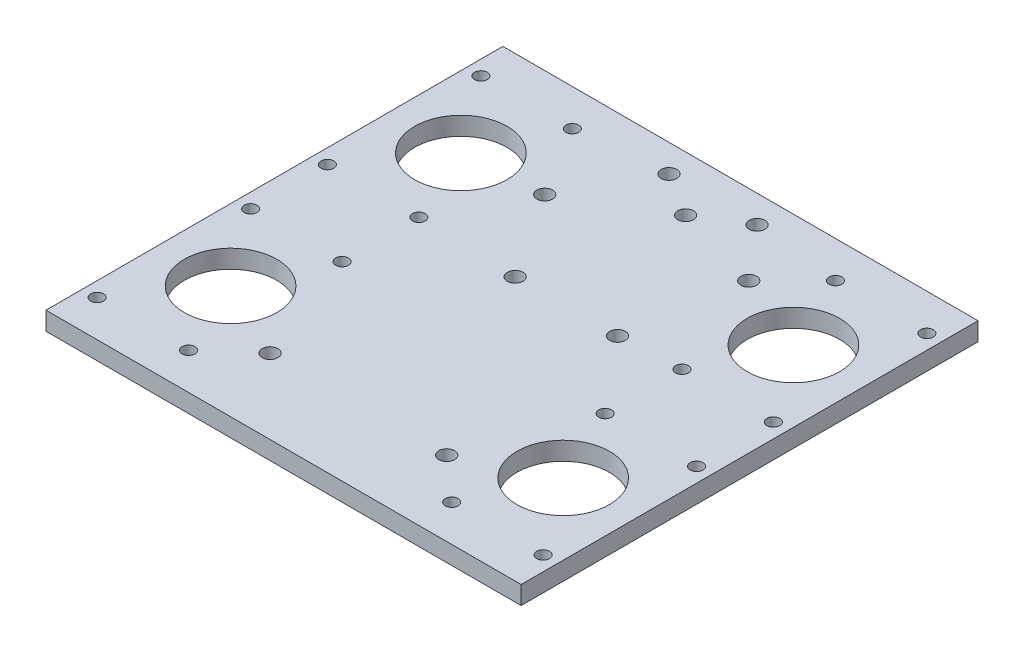
from build123d import *

# Parameters (mm, degrees)
SKETCH1_W                 = 130
SKETCH1_H                 = 125
BOSS_EXTRUDE1_DEPTH       = 5
SKETCH2_R                 = 1.75
SKETCH2_R_2               = 12.65
CUT_EXTRUDE1_DEPTH        = 10
MIRROR4_COPY_1_SKETCH_R   = 1.75
MIRROR4_COPY_1_SKETCH_R_2 = 12.65
MIRROR4_COPY_1_DEPTH      = 10
SKETCH3_R                 = 2.15
CUT_EXTRUDE2_DEPTH        = 10
SKETCH4_R                 = 2.15
CUT_EXTRUDE3_DEPTH        = 10


with BuildPart() as part:
    # Sketch1 → Boss-Extrude1 (new body)
    with BuildSketch(Plane(origin=(0, 0, 0), x_dir=(1, 0, 0), z_dir=(0, 1, 0))):
        Rectangle(SKETCH1_W, SKETCH1_H)
    extrude(amount=BOSS_EXTRUDE1_DEPTH)

    # Sketch2 → Cut-Extrude1 (cut)
    with BuildSketch(Plane(origin=(0, 5, 0), x_dir=(1, 0, 0), z_dir=(0, 1, 0))):
        with Locations(Location((-61, -52.5, 0), (0, 0, 270))):
            Circle(SKETCH2_R)
        with Locations(Location((-36, -52.5, 0), (0, 0, 270))):
            Circle(SKETCH2_R)
        with Locations(Location((-36, -10.5, 0), (0, 0, 270))):
            Circle(SKETCH2_R)
        with Locations(Location((-61, -10.5, 0), (0, 0, 270))):
            Circle(SKETCH2_R)
        with Locations(Location((-45.5, -31.5, 0), (0, 0, 270))):
            Circle(SKETCH2_R_2)
    cut_extrude1 = extrude(amount=-CUT_EXTRUDE1_DEPTH, mode=Mode.SUBTRACT)

    # Mirror3: Cut-Extrude1 across plane
    add(cut_extrude1.mirror(Plane.ZY), mode=Mode.SUBTRACT)

    # Mirror4: Cut-Extrude1 across plane
    add(cut_extrude1.mirror(Plane.XY), mode=Mode.SUBTRACT)

    # Mirror4 copy 1 sketch → Mirror4 copy 1 (cut)
    with BuildSketch(Plane(origin=(0, 5, 0), x_dir=(-1, 0, 0), z_dir=(0, 1, 0))):
        with Locations(Location((-61, -52.5, 0), (0, 0, 270))):
            Circle(MIRROR4_COPY_1_SKETCH_R)
        with Locations(Location((-36, -52.5, 0), (0, 0, 270))):
            Circle(MIRROR4_COPY_1_SKETCH_R)
        with Locations(Location((-36, -10.5, 0), (0, 0, 270))):
            Circle(MIRROR4_COPY_1_SKETCH_R)
        with Locations(Location((-61, -10.5, 0), (0, 0, 270))):
            Circle(MIRROR4_COPY_1_SKETCH_R)
        with Locations(Location((-45.5, -31.5, 0), (0, 0, 270))):
            Circle(MIRROR4_COPY_1_SKETCH_R_2)
    extrude(amount=-MIRROR4_COPY_1_DEPTH, mode=Mode.SUBTRACT)

    # Sketch3 → Cut-Extrude2 (cut)
    with BuildSketch(Plane(origin=(0, 5, 0), x_dir=(1, 0, 0), z_dir=(0, 1, 0))):
        with Locations(Location((-24.17, -42.03, 0), (0, 0, 270))):
            Circle(SKETCH3_R)
        with Locations(Location((24.17, -42.03, 0), (0, 0, 270))):
            Circle(SKETCH3_R)
        with Locations(Location((-8.73, 9.6, 0), (0, 0, 270))):
            Circle(SKETCH3_R)
        with Locations(Location((19.29, 9.6, 0), (0, 0, 270))):
            Circle(SKETCH3_R)
        with Locations(Location((-24.17, 33.11, 0), (0, 0, 270))):
            Circle(SKETCH3_R)
        with Locations(Location((24.17, 40.6, 0), (0, 0, 270))):
            Circle(SKETCH3_R)
    extrude(amount=-CUT_EXTRUDE2_DEPTH, mode=Mode.SUBTRACT)

    # Sketch4 → Cut-Extrude3 (cut)
    with BuildSketch(Plane(origin=(0, 5, 0), x_dir=(1, 0, 0), z_dir=(0, 1, 0))):
        with Locations(Location((0, 47.5, 0), (0, 0, 270))):
            Circle(SKETCH4_R)
        with Locations(Location((12.049810205, 55, 0), (0, 0, 270))):
            Circle(SKETCH4_R)
        with Locations(Location((-12.049810205, 55, 0), (0, 0, 270))):
            Circle(SKETCH4_R)
    extrude(amount=-CUT_EXTRUDE3_DEPTH, mode=Mode.SUBTRACT)


solid = part.part
